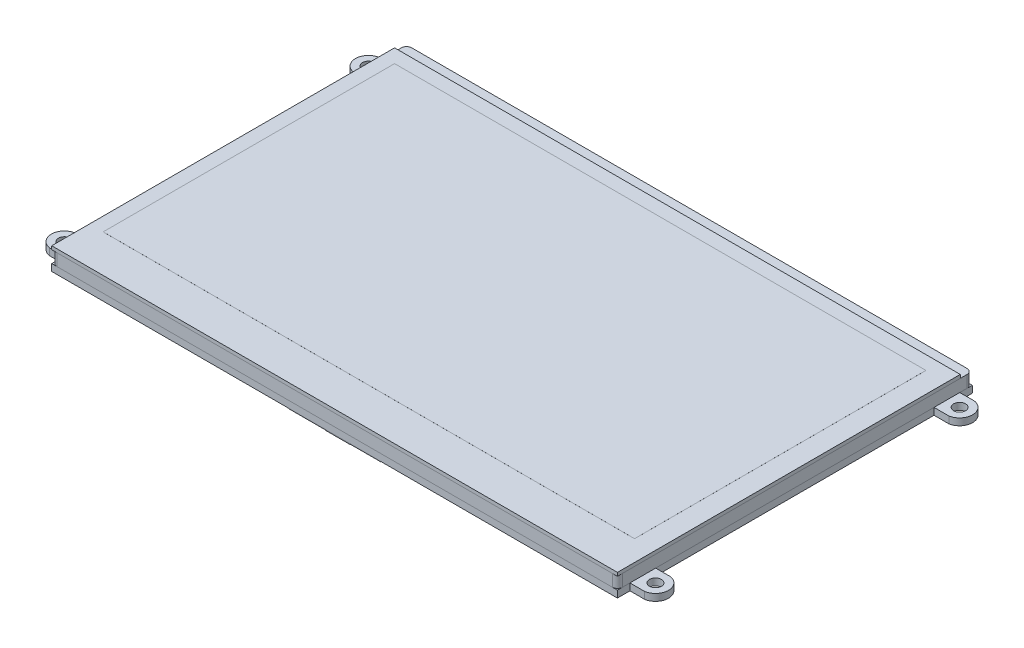
from build123d import *

# Parameters (mm, degrees)
ESQUISSE1_W        = 165
ESQUISSE1_H        = 100
BOSS_EXTRU_1_DEPTH = 1
ESQUISSE3_W        = 165
ESQUISSE3_H        = 103.5
BOSS_EXTRU_2_DEPTH = 3.5
CONG_1_R           = 1.5
ESQUISSE4_R        = 1.75
BOSS_EXTRU_3_DEPTH = 2
BOSS_EXTRU_4_DEPTH = 0.1
ESQUISSE7_W        = 25
ESQUISSE7_H        = 5.5
BOSS_EXTRU_5_DEPTH = 2
ESQUISSE9_W        = 7
ESQUISSE9_H        = 60
BOSS_EXTRU_6_DEPTH = 0.1
ESQUISSE10_W       = 13
ESQUISSE10_H       = 5
BOSS_EXTRU_8_DEPTH = 2
ESQUISSE11_W       = 155
ESQUISSE11_H       = 85
BOSS_EXTRU_9_DEPTH = 0.01


with BuildPart() as part:
    # Esquisse1 → Boss.-Extru.1 (new body)
    with BuildSketch(Plane(origin=(0, 0, 0), x_dir=(1, 0, 0), z_dir=(0, 1, 0))):
        Rectangle(ESQUISSE1_W, ESQUISSE1_H)
    extrude(amount=BOSS_EXTRU_1_DEPTH)

    # Esquisse11 → Boss.-Extru.9 (add)
    with BuildSketch(Plane(origin=(0, 1, 0), x_dir=(1, 0, 0), z_dir=(0, 1, 0))):
        with Locations((-1, 3.5)):
            Rectangle(ESQUISSE11_W, ESQUISSE11_H)
    extrude(amount=BOSS_EXTRU_9_DEPTH)


with BuildPart() as body_2:
    # Esquisse3 → Boss.-Extru.2 (new body)
    with BuildSketch(Plane.XZ):
        with Locations((0, -1.75)):
            Rectangle(ESQUISSE3_W, ESQUISSE3_H)
    extrude(amount=BOSS_EXTRU_2_DEPTH)

    # Congé1
    cong_1_edges = [body_2.edges().sort_by_distance(p)[0] for p in [
        (-82.5, -1.75, 50),
        (82.5, -1.75, 50),
        (82.5, -1.75, -53.5),
        (-82.5, -1.75, -53.5),
    ]]
    fillet(cong_1_edges, radius=CONG_1_R)


with BuildPart() as body_3:
    # Esquisse4 → Boss.-Extru.3 (new body)
    with BuildSketch(Plane.XZ.offset(3.5)):
        with BuildLine():
            Line((82.5, -53.5), (-82.5, -53.5))
            Line((-82.5, -53.5), (-82.5, -49.85))
            Line((-82.5, -49.85), (-86.814410286, -49.85))
            ThreePointArc((-86.814410286, -49.85), (-90, -46.1), (-86.814410286, -42.35))
            Line((-86.814410286, -42.35), (-82.5, -42.35))
            Line((-82.5, -42.35), (-82.5, 38.85))
            Line((-82.5, 38.85), (-86.814410286, 38.85))
            ThreePointArc((-86.814410286, 38.85), (-90, 42.6), (-86.814410286, 46.35))
            Line((-86.814410286, 46.35), (-82.5, 46.35))
            Line((-82.5, 46.35), (-82.5, 50))
            Line((-82.5, 50), (82.5, 50))
            Line((82.5, 50), (82.5, 46.35))
            Line((82.5, 46.35), (86.814410286, 46.35))
            ThreePointArc((86.814410286, 46.35), (90, 42.6), (86.814410286, 38.85))
            Line((86.814410286, 38.85), (82.5, 38.85))
            Line((82.5, 38.85), (82.5, -42.35))
            Line((82.5, -42.35), (86.814410286, -42.35))
            ThreePointArc((86.814410286, -42.35), (90, -46.1), (86.814410286, -49.85))
            Line((86.814410286, -49.85), (82.5, -49.85))
            Line((82.5, -49.85), (82.5, -53.5))
        make_face()
        with Locations(Location((86.2, 42.6, 0), (0, 0, 270))):
            Circle(ESQUISSE4_R, mode=Mode.SUBTRACT)
        with Locations(Location((-86.2, 42.6, 0), (0, 0, 90))):
            Circle(ESQUISSE4_R, mode=Mode.SUBTRACT)
        with Locations(Location((-86.2, -46.1, 0), (0, 0, 270))):
            Circle(ESQUISSE4_R, mode=Mode.SUBTRACT)
        with Locations(Location((86.2, -46.1, 0), (0, 0, 90))):
            Circle(ESQUISSE4_R, mode=Mode.SUBTRACT)
    extrude(amount=BOSS_EXTRU_3_DEPTH)


with BuildPart() as body_4:
    # Esquisse6 → Boss.-Extru.4 (new body)
    with BuildSketch(Plane.XZ.offset(5.5)):
        Polygon((13.5, 50), (13.5, 21.5), (-40.5, 21.5), (-40.5, -14), (-60.5, -14), (-60.5, 45.5), (-13.5, 45.5), (-13.5, 50), align=None)
    extrude(amount=BOSS_EXTRU_4_DEPTH)

    # Esquisse7 → Boss.-Extru.5 (add)
    with BuildSketch(Plane.XZ.offset(5.5)):
        with Locations((-50.5, -16.75)):
            Rectangle(ESQUISSE7_W, ESQUISSE7_H)
    extrude(amount=BOSS_EXTRU_5_DEPTH)

    # Esquisse9 → Boss.-Extru.6 (add)
    with BuildSketch(Plane.XZ.offset(5.6)):
        with Locations((1, 20)):
            Rectangle(ESQUISSE9_W, ESQUISSE9_H)
    extrude(amount=BOSS_EXTRU_6_DEPTH)

    # Esquisse10 → Boss.-Extru.8 (add)
    with BuildSketch(Plane.XZ.offset(5.5)):
        with Locations((1, -12.5)):
            Rectangle(ESQUISSE10_W, ESQUISSE10_H)
    extrude(amount=BOSS_EXTRU_8_DEPTH)


solid = Compound([part.part, body_2.part, body_3.part, body_4.part])
